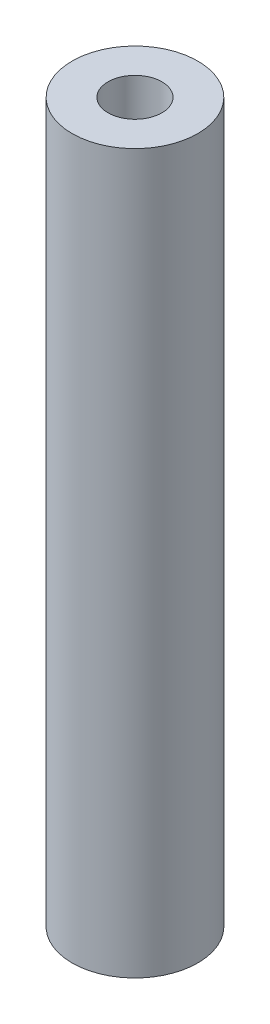
from build123d import *

# Parameters (mm, degrees)
SKETCH1_R           = 3.5
SKETCH1_R_2         = 1.5
BOSS_EXTRUDE1_DEPTH = 40


with BuildPart() as part:
    # Sketch1 → Boss-Extrude1 (new body)
    with BuildSketch(Plane(origin=(0, 0, 0), x_dir=(1, 0, 0), z_dir=(0, 1, 0))):
        with Locations(Location((0, 0, 0), (0, 0, 270))):
            Circle(SKETCH1_R)
        with Locations(Location((0, 0, 0), (0, 0, 270))):
            Circle(SKETCH1_R_2, mode=Mode.SUBTRACT)
    extrude(amount=BOSS_EXTRUDE1_DEPTH)


solid = part.part
